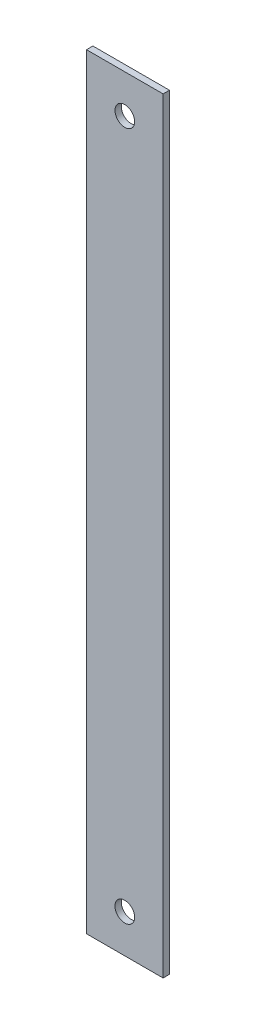
from build123d import *

# Parameters (mm, degrees)
SKETCH1_W                = 38.1
SKETCH1_H                = 381
BOSS_EXTRUDE1_DEPTH      = 3.175
W_0_386_DIAMETER_HOLE1_D = 9.8044


with BuildPart() as part:
    # Sketch1 → Boss-Extrude1 (new body)
    with BuildSketch(Plane.XY):
        with Locations((19.05, 190.5)):
            Rectangle(SKETCH1_W, SKETCH1_H)
    extrude(amount=BOSS_EXTRUDE1_DEPTH)

    # W (0.386) Diameter Hole1 (through all)
    with Locations(Plane.XY.offset(3.175)):
        with Locations((19.05, 361.95), (19.05, 19.05)):
            Hole(W_0_386_DIAMETER_HOLE1_D / 2)


solid = part.part
